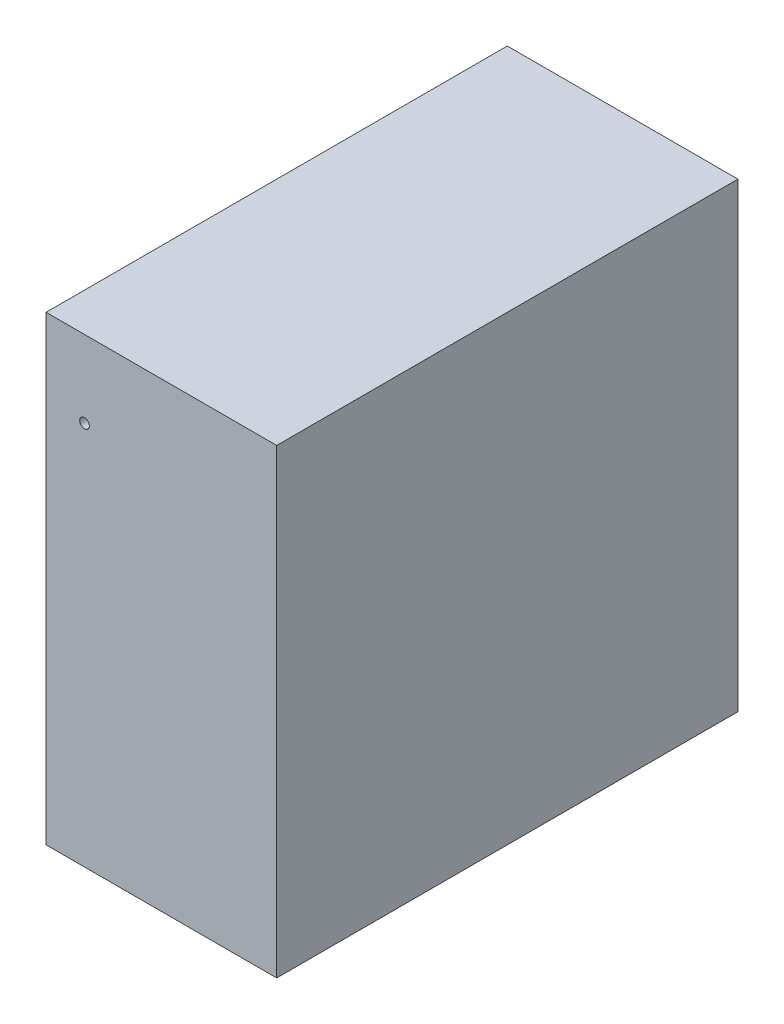
from build123d import *

# Parameters (mm, degrees)
SKETCH1_W           = 152.4
SKETCH1_H           = 304.8
SKETCH1_R           = 3.175
BOSS_EXTRUDE1_DEPTH = 304.8


with BuildPart() as part:
    # Sketch1 → Boss-Extrude1 (new body)
    with BuildSketch(Plane.XY):
        Rectangle(SKETCH1_W, SKETCH1_H)
        with Locations(Location((-50.8, 101.6, 0), (0, 0, 180))):
            Circle(SKETCH1_R, mode=Mode.SUBTRACT)
    extrude(amount=BOSS_EXTRUDE1_DEPTH)


solid = part.part
